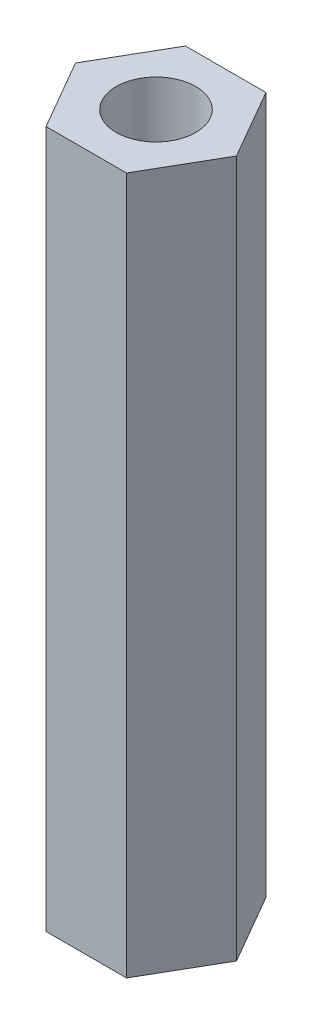
from build123d import *

# Parameters (mm, degrees)
SKETCH1_R           = 2
BOSS_EXTRUDE1_DEPTH = 35


with BuildPart() as part:
    # Sketch1 → Boss-Extrude1 (new body)
    with BuildSketch(Plane(origin=(0, 0, 0), x_dir=(1, 0, 0), z_dir=(0, 1, 0))):
        Polygon((2.020725942, 3.5), (-2.020725942, 3.5), (-4.041451884, 0), (-2.020725942, -3.5), (2.020725942, -3.5), (4.041451884, 0), align=None)
        with Locations(Location((0, 0, 0), (0, 0, 270))):
            Circle(SKETCH1_R, mode=Mode.SUBTRACT)
    extrude(amount=BOSS_EXTRUDE1_DEPTH)


solid = part.part
